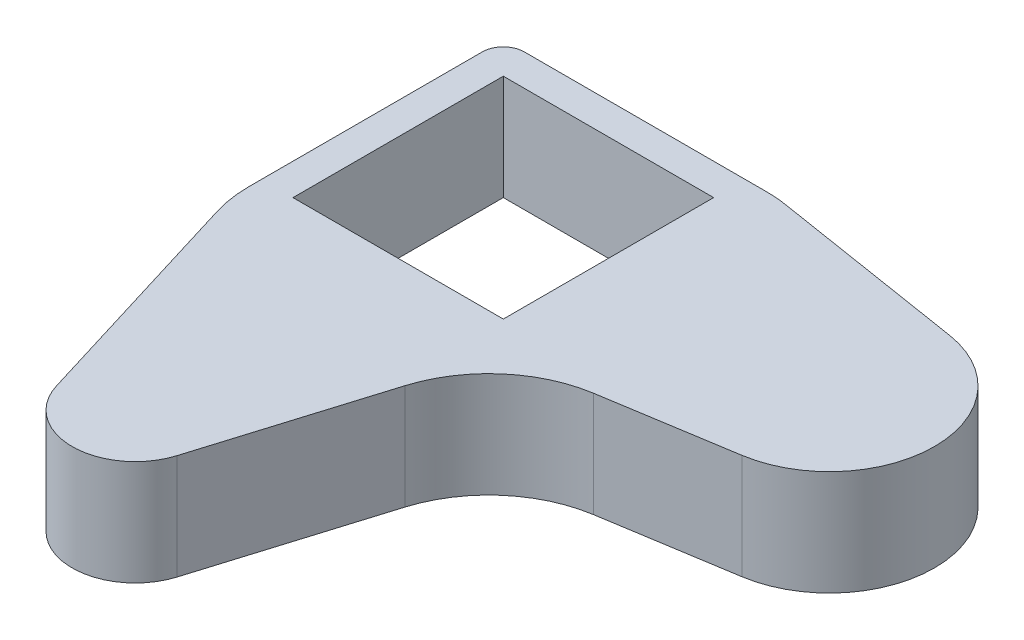
from build123d import *

# Parameters (mm, degrees)
SKETCH1_W           = 20
SKETCH1_H           = 20
BOSS_EXTRUDE1_DEPTH = 10


with BuildPart() as part:
    # Sketch1 → Boss-Extrude1 (new body)
    with BuildSketch(Plane(origin=(0, 0, 0), x_dir=(1, 0, 0), z_dir=(0, 1, 0))):
        with BuildLine():
            Line((23.939871077, 2.849965846), (42.576368333, -0.125028462))
            ThreePointArc((42.576368333, -0.125028462), (51, -10), (42.576368333, -19.874971538))
            Line((42.576368333, -19.874971538), (30.394725659, -21.819560004))
            ThreePointArc((30.394725659, -21.819560004), (24.408108439, -24.617839175), (20.810680125, -30.161165034))
            Line((20.810680125, -30.161165034), (15.737843767, -46.754180408))
            ThreePointArc((15.737843767, -46.754180408), (10, -51), (4.262156233, -46.754180408))
            Line((4.262156233, -46.754180408), (-2.475687534, -24.71500206))
            ThreePointArc((-2.475687534, -24.71500206), (-2.868198061, -22.980302653), (-3, -21.206641244))
            Line((-3, -21.206641244), (-3, 1))
            ThreePointArc((-3, 1), (-2.414213562, 2.414213562), (-1, 3))
            Line((-1, 3), (22.048229077, 3))
            ThreePointArc((22.048229077, 3), (22.997020375, 2.962432657), (23.939871077, 2.849965846))
        make_face()
        with Locations((10, -10)):
            Rectangle(SKETCH1_W, SKETCH1_H, mode=Mode.SUBTRACT)
    extrude(amount=BOSS_EXTRUDE1_DEPTH)


solid = part.part
